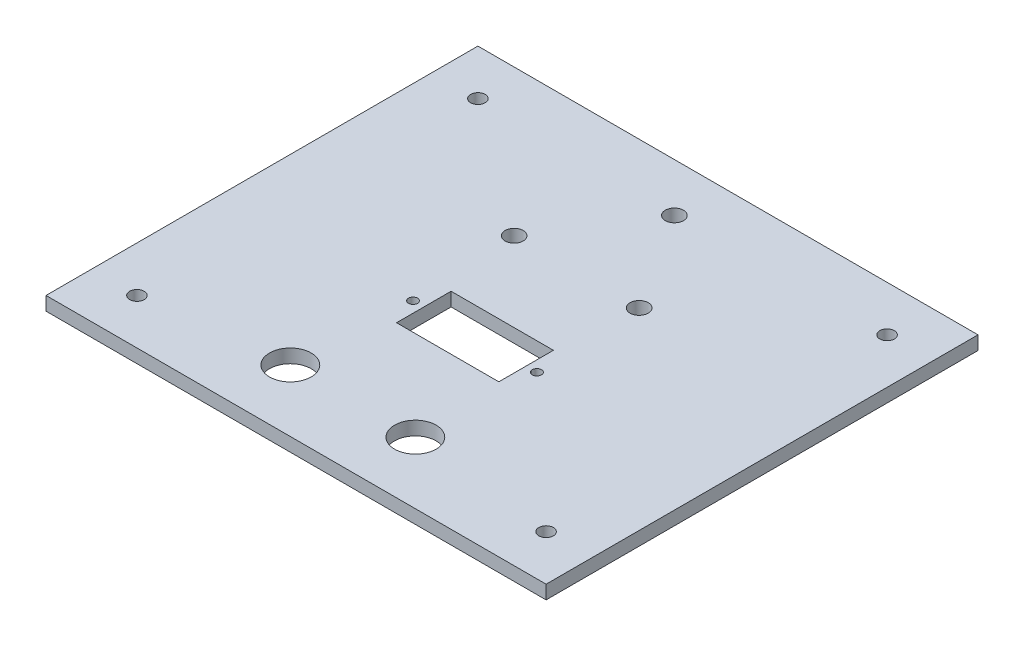
from build123d import *

# Parameters (mm, degrees)
SKETCH1_W           = 110
SKETCH1_H           = 95
SKETCH1_R           = 2
BOSS_EXTRUDE1_DEPTH = 3
SKETCH2_R           = 1.6
CUT_EXTRUDE1_DEPTH  = 3
SKETCH4_R           = 4.575
CUT_EXTRUDE3_DEPTH  = 3
SKETCH5_R           = 1
SKETCH5_W           = 22.5
SKETCH5_H           = 12
CUT_EXTRUDE4_DEPTH  = 10


with BuildPart() as part:
    # Sketch1 → Boss-Extrude1 (new body)
    with BuildSketch(Plane(origin=(0, 0, 0), x_dir=(1, 0, 0), z_dir=(0, 1, 0))):
        Rectangle(SKETCH1_W, SKETCH1_H)
        with Locations(Location((-1.134990048, 36.85560657, 0), (0, 0, 270))):
            Circle(SKETCH1_R, mode=Mode.SUBTRACT)
        with Locations(Location((-14.884990048, 15.35560657, 0), (0, 0, 270))):
            Circle(SKETCH1_R, mode=Mode.SUBTRACT)
        with Locations(Location((12.615009952, 15.35560657, 0), (0, 0, 270))):
            Circle(SKETCH1_R, mode=Mode.SUBTRACT)
    extrude(amount=BOSS_EXTRUDE1_DEPTH)

    # Sketch2 → Cut-Extrude1 (cut)
    with BuildSketch(Plane(origin=(0, 3, 0), x_dir=(1, 0, 0), z_dir=(0, 1, 0))):
        with Locations(Location((-45, 37.5, 0), (0, 0, 270))):
            Circle(SKETCH2_R)
        with Locations(Location((45, 37.5, 0), (0, 0, 270))):
            Circle(SKETCH2_R)
        with Locations(Location((-45, -37.5, 0), (0, 0, 270))):
            Circle(SKETCH2_R)
        with Locations(Location((45, -37.5, 0), (0, 0, 270))):
            Circle(SKETCH2_R)
    extrude(amount=-CUT_EXTRUDE1_DEPTH, mode=Mode.SUBTRACT)

    # Sketch4 → Cut-Extrude3 (cut)
    with BuildSketch(Plane(origin=(0, 3, 0), x_dir=(1, 0, 0), z_dir=(0, 1, 0))):
        with Locations(Location((-14.884990048, -33.869690938, 0), (0, 0, 270))):
            Circle(SKETCH4_R)
        with Locations(Location((12.615009952, -33.869690938, 0), (0, 0, 270))):
            Circle(SKETCH4_R)
    extrude(amount=-CUT_EXTRUDE3_DEPTH, mode=Mode.SUBTRACT)

    # Sketch5 → Cut-Extrude4 (cut)
    with BuildSketch(Plane(origin=(0, 3, 0), x_dir=(1, 0, 0), z_dir=(0, 1, 0))):
        with Locations(Location((-13.625, -8.147125206, 0), (0, 0, 270))):
            Circle(SKETCH5_R)
        with Locations(Location((13.625, -8.147125206, 0), (0, 0, 270))):
            Circle(SKETCH5_R)
        with Locations((0, -8.147125206)):
            Rectangle(SKETCH5_W, SKETCH5_H)
    extrude(amount=-CUT_EXTRUDE4_DEPTH, mode=Mode.SUBTRACT)


solid = part.part
